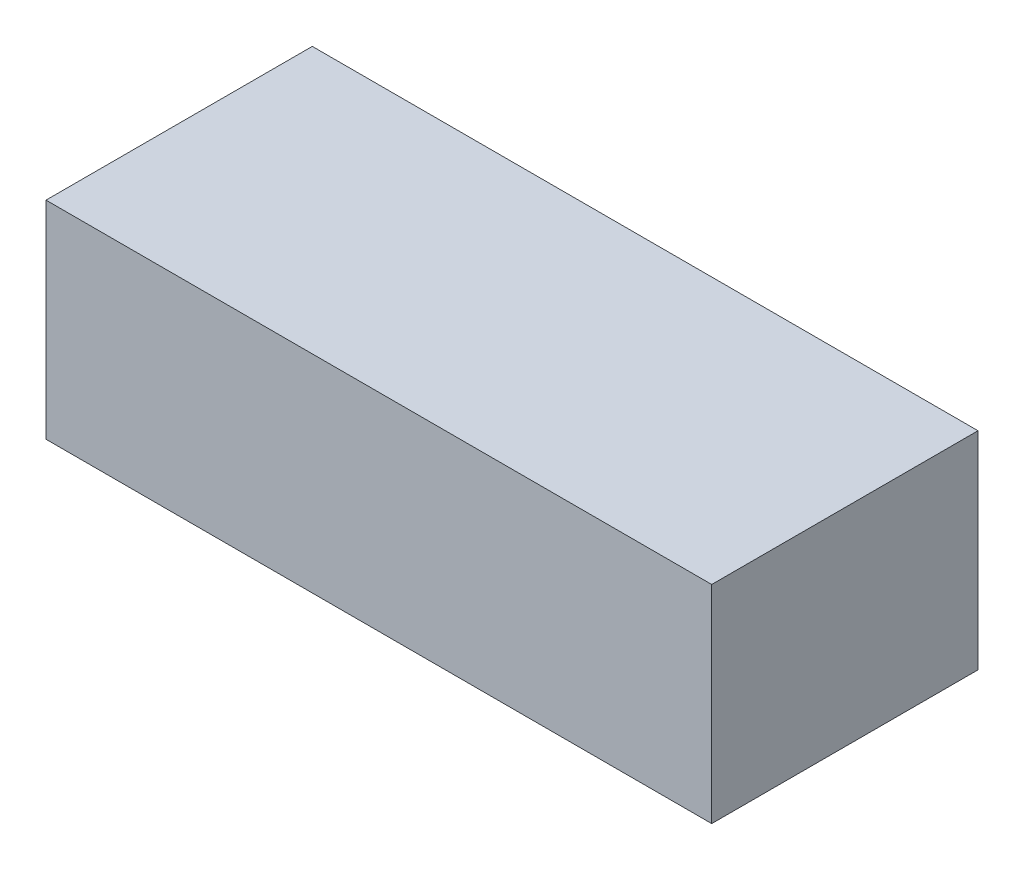
from build123d import *

# Parameters (mm, degrees)
SKETCH1_W           = 225
SKETCH1_H           = 90
BOSS_EXTRUDE1_DEPTH = 70


with BuildPart() as part:
    # Sketch1 → Boss-Extrude1 (new body)
    with BuildSketch(Plane(origin=(0, 0, 0), x_dir=(1, 0, 0), z_dir=(0, 1, 0))):
        Rectangle(SKETCH1_W, SKETCH1_H)
    extrude(amount=BOSS_EXTRUDE1_DEPTH)


solid = part.part
